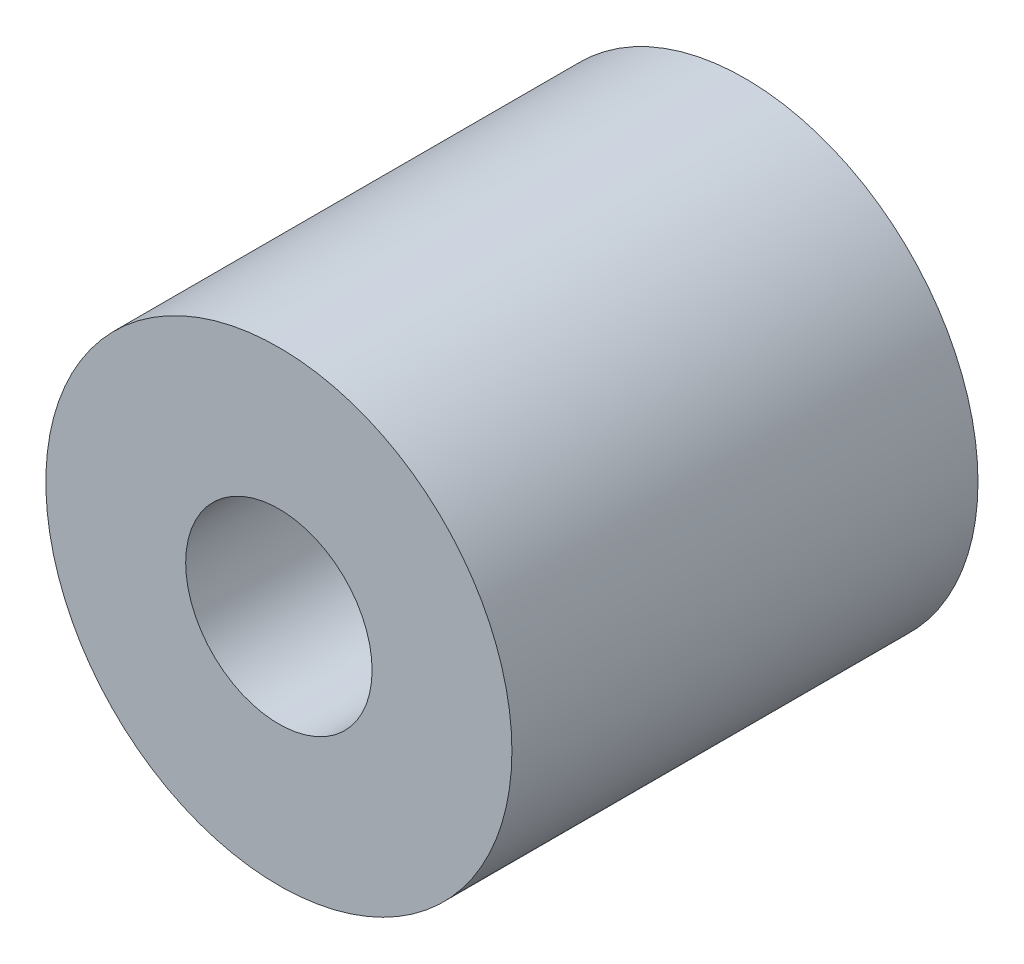
from build123d import *

# Parameters (mm, degrees)
SKETCH_1_R      = 4
SKETCH_1_R_2    = 1.6
EXTRUDE_1_DEPTH = 8


with BuildPart() as part:
    # Эскиз1 → Бобышка-Вытянуть1 (new body)
    with BuildSketch(Plane.XY):
        Circle(SKETCH_1_R)
        Circle(SKETCH_1_R_2, mode=Mode.SUBTRACT)
    extrude(amount=EXTRUDE_1_DEPTH)


solid = part.part
